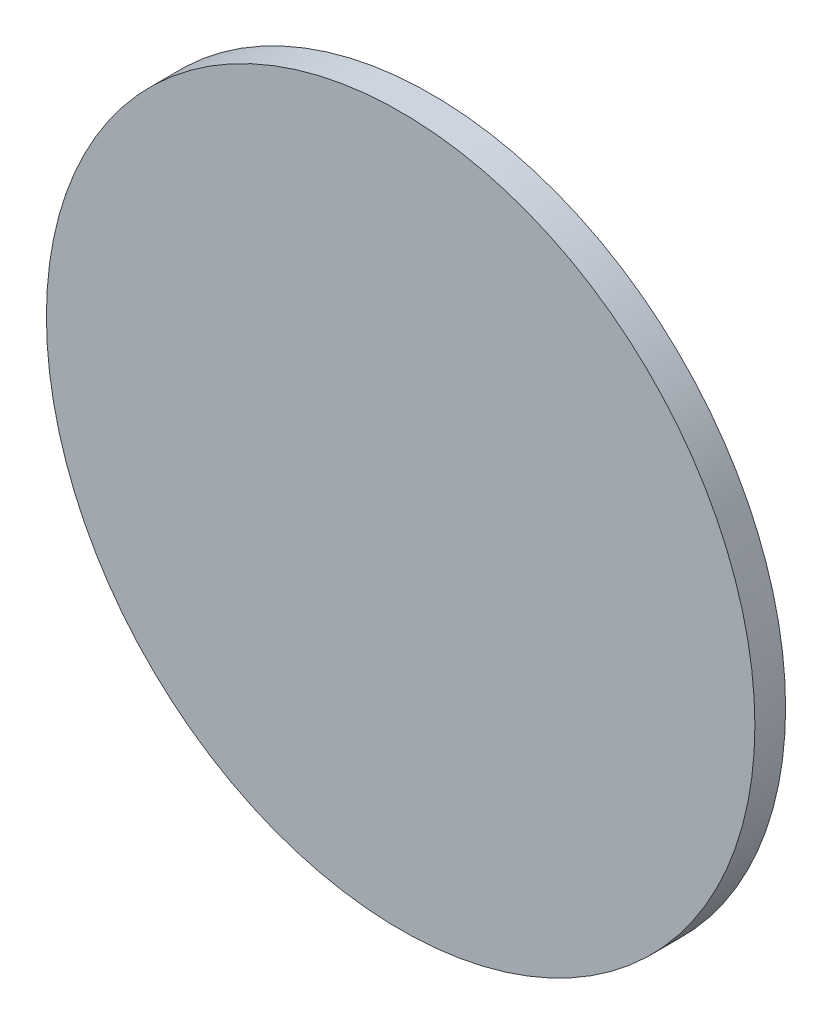
from build123d import *

# Parameters (mm, degrees)
SKETCH1_R      = 23.07082
EXTRUDE1_DEPTH = 2.000000064


with BuildPart() as part:
    # Sketch1 → Extrude1 (new body)
    with BuildSketch(Plane.XY):
        Circle(SKETCH1_R)
    extrude(amount=EXTRUDE1_DEPTH)


solid = part.part
